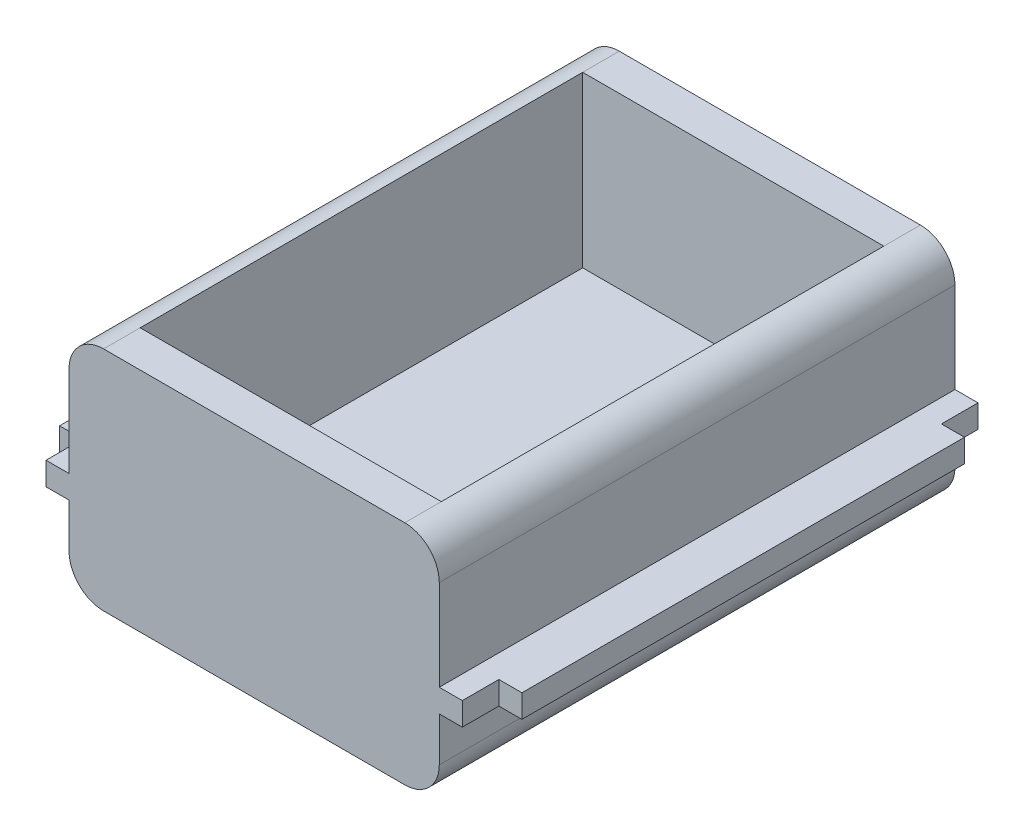
from build123d import *

# Parameters (mm, degrees)
BOSS_EXTRUDE3_DEPTH      = 1.5875
BOSS_EXTRUDE3_DEPTH_BACK = 43.175
SKETCH4_W                = 26.136325312
SKETCH4_H                = 38.4125
CUT_EXTRUDE1_DEPTH       = 14.701439982
SKETCH5_W                = 2
SKETCH5_H                = 2
BOSS_EXTRUDE5_DEPTH      = 44.7625
BOSS_EXTRUDE6_START      = -41.5875
SKETCH5_4_W              = 2
SKETCH5_4_H              = 2
BOSS_EXTRUDE6_DEPTH      = 38.4125


with BuildPart() as part:
    # Sketch3 → Boss-Extrude3 (new, two sides: drawn at the far end of the back side and taken through both)
    with BuildSketch(Plane.XY.offset(336.564940884).offset(-BOSS_EXTRUDE3_DEPTH_BACK)):
        with BuildLine():
            Line((-13.068162656, -2.834098381), (13.068162656, -2.834098381))
            ThreePointArc((13.068162656, -2.834098381), (15.189482999, -1.955418725), (16.068162656, 0.165901619))
            Line((16.068162656, 0.165901619), (16.068162656, 13.867341601))
            ThreePointArc((16.068162656, 13.867341601), (15.189482999, 15.988661944), (13.068162656, 16.867341601))
            Line((13.068162656, 16.867341601), (-13.068162656, 16.867341601))
            ThreePointArc((-13.068162656, 16.867341601), (-15.189482999, 15.988661944), (-16.068162656, 13.867341601))
            Line((-16.068162656, 13.867341601), (-16.068162656, 0.165901619))
            ThreePointArc((-16.068162656, 0.165901619), (-15.189482999, -1.955418725), (-13.068162656, -2.834098381))
        make_face()
    extrude(amount=BOSS_EXTRUDE3_DEPTH + BOSS_EXTRUDE3_DEPTH_BACK)

    # Sketch4 → Cut-Extrude1 (cut)
    with BuildSketch(Plane(origin=(0, 16.867341601, 0), x_dir=(1, 0, 0), z_dir=(0, 1, 0))):
        with Locations((0, -315.771190884)):
            Rectangle(SKETCH4_W, SKETCH4_H)
    extrude(amount=-CUT_EXTRUDE1_DEPTH, mode=Mode.SUBTRACT)

    # Sketch5 → Boss-Extrude5 (add)
    with BuildSketch(Plane.XY.offset(338.152440884)):
        with Locations((-17.068162656, 5)):
            Rectangle(SKETCH5_W, SKETCH5_H)
        with Locations((17.068162656, 5)):
            Rectangle(SKETCH5_W, SKETCH5_H)
    extrude(amount=-BOSS_EXTRUDE5_DEPTH)

    # Sketch5<4> → Boss-Extrude6 (add)
    with BuildSketch(Plane.XY.offset(338.152440884).offset(BOSS_EXTRUDE6_START)):
        with Locations((19.068162656, 5)):
            Rectangle(SKETCH5_4_W, SKETCH5_4_H)
        with Locations((-19.068162656, 5)):
            Rectangle(SKETCH5_4_W, SKETCH5_4_H)
    extrude(amount=BOSS_EXTRUDE6_DEPTH)


solid = part.part
